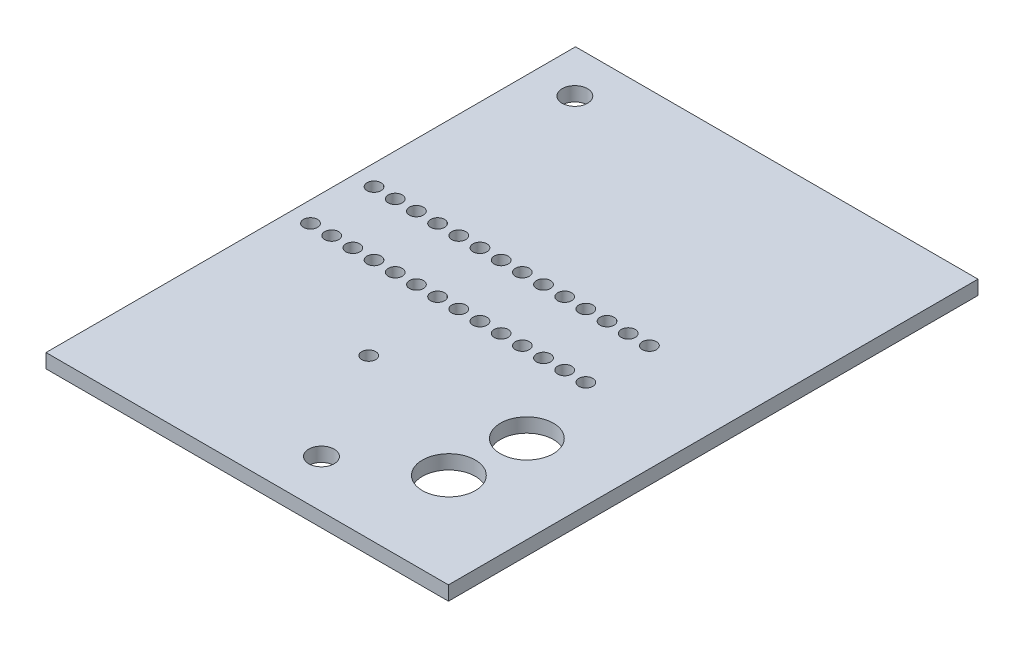
from build123d import *

# Parameters (mm, degrees)
SKETCH1_W           = 48.26
SKETCH1_H           = 63.5
BOSS_EXTRUDE1_DEPTH = 1.7
SKETCH3_R           = 3.175
SKETCH3_R_2         = 0.8382
SKETCH3_R_3         = 1.524
CUT_EXTRUDE1_DEPTH  = 80.775733152


with BuildPart() as part:
    # Sketch1 → Boss-Extrude1 (new body)
    with BuildSketch(Plane(origin=(0, 0, 0), x_dir=(1, 0, 0), z_dir=(0, 1, 0))):
        with Locations((24.13, 31.75)):
            Rectangle(SKETCH1_W, SKETCH1_H)
    extrude(amount=BOSS_EXTRUDE1_DEPTH)

    # Sketch3 → Cut-Extrude1 (cut, through all)
    with BuildSketch(Plane(origin=(0, 1.7, 0), x_dir=(1, 0, 0), z_dir=(0, 1, 0))):
        with Locations(Location((37.75456, 19.90598, 0), (0, 0, 270))):
            Circle(SKETCH3_R)
        with Locations(Location((36.9062, 11.4046, 0), (0, 0, 270))):
            Circle(SKETCH3_R)
        with Locations(Location((2.44856, 29.26842, 0), (0, 0, 270))):
            Circle(SKETCH3_R_2)
        with Locations(Location((4.98856, 29.26842, 0), (0, 0, 270))):
            Circle(SKETCH3_R_2)
        with Locations(Location((7.52856, 29.26842, 0), (0, 0, 270))):
            Circle(SKETCH3_R_2)
        with Locations(Location((10.06856, 29.26842, 0), (0, 0, 270))):
            Circle(SKETCH3_R_2)
        with Locations(Location((12.60856, 29.26842, 0), (0, 0, 270))):
            Circle(SKETCH3_R_2)
        with Locations(Location((15.14856, 29.26842, 0), (0, 0, 270))):
            Circle(SKETCH3_R_2)
        with Locations(Location((17.68856, 29.26842, 0), (0, 0, 270))):
            Circle(SKETCH3_R_2)
        with Locations(Location((20.22856, 29.26842, 0), (0, 0, 270))):
            Circle(SKETCH3_R_2)
        with Locations(Location((22.76856, 29.26842, 0), (0, 0, 270))):
            Circle(SKETCH3_R_2)
        with Locations(Location((25.30856, 29.26842, 0), (0, 0, 270))):
            Circle(SKETCH3_R_2)
        with Locations(Location((27.84856, 29.26842, 0), (0, 0, 270))):
            Circle(SKETCH3_R_2)
        with Locations(Location((30.38856, 29.26842, 0), (0, 0, 270))):
            Circle(SKETCH3_R_2)
        with Locations(Location((32.92856, 29.26842, 0), (0, 0, 270))):
            Circle(SKETCH3_R_2)
        with Locations(Location((35.46856, 29.26842, 0), (0, 0, 270))):
            Circle(SKETCH3_R_2)
        with Locations(Location((4.98856, 36.88842, 0), (0, 0, 270))):
            Circle(SKETCH3_R_2)
        with Locations(Location((7.52856, 36.88842, 0), (0, 0, 270))):
            Circle(SKETCH3_R_2)
        with Locations(Location((10.06856, 36.88842, 0), (0, 0, 270))):
            Circle(SKETCH3_R_2)
        with Locations(Location((12.60856, 36.88842, 0), (0, 0, 270))):
            Circle(SKETCH3_R_2)
        with Locations(Location((15.14856, 36.88842, 0), (0, 0, 270))):
            Circle(SKETCH3_R_2)
        with Locations(Location((17.68856, 36.88842, 0), (0, 0, 270))):
            Circle(SKETCH3_R_2)
        with Locations(Location((20.22856, 36.88842, 0), (0, 0, 270))):
            Circle(SKETCH3_R_2)
        with Locations(Location((22.76856, 36.88842, 0), (0, 0, 270))):
            Circle(SKETCH3_R_2)
        with Locations(Location((25.30856, 36.88842, 0), (0, 0, 270))):
            Circle(SKETCH3_R_2)
        with Locations(Location((27.84856, 36.88842, 0), (0, 0, 270))):
            Circle(SKETCH3_R_2)
        with Locations(Location((30.38856, 36.88842, 0), (0, 0, 270))):
            Circle(SKETCH3_R_2)
        with Locations(Location((32.92856, 36.88842, 0), (0, 0, 270))):
            Circle(SKETCH3_R_2)
        with Locations(Location((35.46856, 36.88842, 0), (0, 0, 270))):
            Circle(SKETCH3_R_2)
        with Locations(Location((2.44856, 36.88842, 0), (0, 0, 270))):
            Circle(SKETCH3_R_2)
        with Locations(Location((27.31008, 5.72008, 0), (0, 0, 270))):
            Circle(SKETCH3_R_3)
        with Locations(Location((5.0673, 58.34634, 0), (0, 0, 270))):
            Circle(SKETCH3_R_3)
        with Locations(Location((19.6723, 19.02714, 0), (0, 0, 270))):
            Circle(SKETCH3_R_2)
    extrude(amount=-CUT_EXTRUDE1_DEPTH, mode=Mode.SUBTRACT)


solid = part.part
